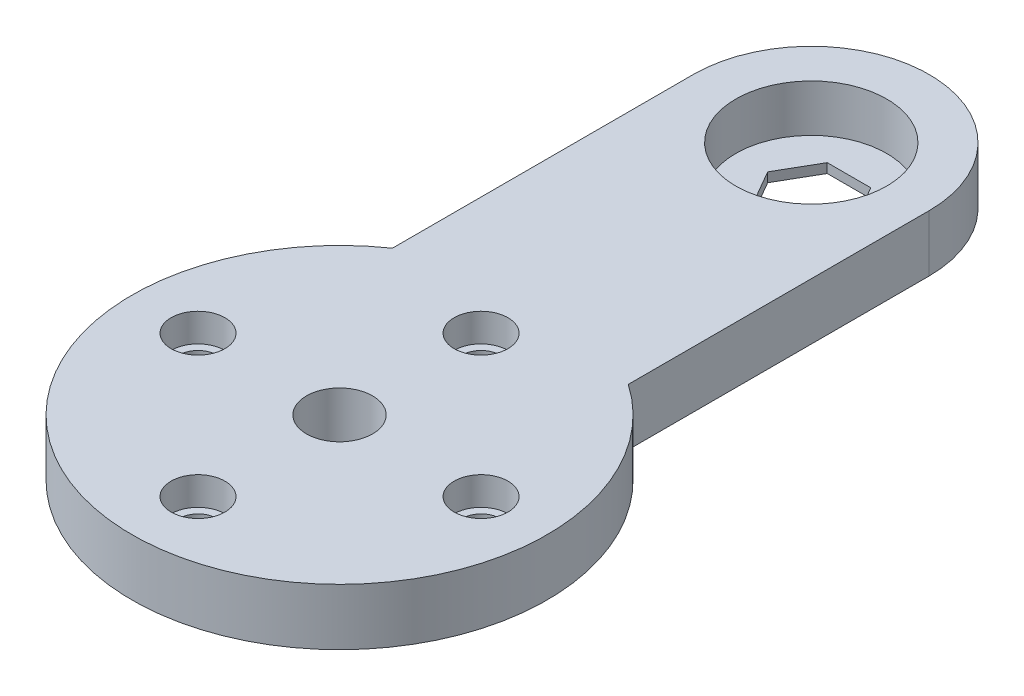
from build123d import *

# Parameters (mm, degrees)
BOSS_EXTRUDE1_DEPTH = 6
SKETCH2_R           = 2.85
CUT_EXTRUDE1_DEPTH  = 3
SKETCH3_R           = 2
SKETCH3_R_2         = 3.5
CUT_EXTRUDE2_DEPTH  = 76.524830354
SKETCH4_R           = 8
CUT_EXTRUDE3_DEPTH  = 5
SKETCH5_R           = 3.5
CUT_EXTRUDE4_DEPTH  = 76.524830354
CUT_EXTRUDE5_DEPTH  = 3


with BuildPart() as part:
    # Sketch1 → Boss-Extrude1 (new body)
    with BuildSketch(Plane(origin=(0, 0, 0), x_dir=(1, 0, 0), z_dir=(0, 1, 0))):
        with BuildLine():
            Line((-12.5, 0), (-12.5, -31.89613301))
            ThreePointArc((-12.5, -31.89613301), (0, -72), (12.5, -31.89613301))
            Line((12.5, -31.89613301), (12.5, 0))
            ThreePointArc((12.5, 0), (0, 12.5), (-12.5, 0))
        make_face()
    extrude(amount=BOSS_EXTRUDE1_DEPTH)

    # Sketch2 → Cut-Extrude1 (cut)
    with BuildSketch(Plane(origin=(0, 6, 0), x_dir=(1, 0, 0), z_dir=(0, 1, 0))):
        with Locations(Location((0, -35, 0), (0, 0, 270))):
            Circle(SKETCH2_R)
        with Locations(Location((15, -50, 0), (0, 0, 270))):
            Circle(SKETCH2_R)
        with Locations(Location((0, -65, 0), (0, 0, 270))):
            Circle(SKETCH2_R)
        with Locations(Location((-15, -50, 0), (0, 0, 270))):
            Circle(SKETCH2_R)
    extrude(amount=-CUT_EXTRUDE1_DEPTH, mode=Mode.SUBTRACT)

    # Sketch3 → Cut-Extrude2 (cut, through all)
    with BuildSketch(Plane(origin=(0, 6, 0), x_dir=(1, 0, 0), z_dir=(0, 1, 0))):
        with Locations(Location((0, -35, 0), (0, 0, 270))):
            Circle(SKETCH3_R)
        with Locations(Location((15, -50, 0), (0, 0, 270))):
            Circle(SKETCH3_R)
        with Locations(Location((0, -65, 0), (0, 0, 270))):
            Circle(SKETCH3_R)
        with Locations(Location((-15, -50, 0), (0, 0, 270))):
            Circle(SKETCH3_R)
        with Locations(Location((0, -50, 0), (0, 0, 270))):
            Circle(SKETCH3_R_2)
    extrude(amount=-CUT_EXTRUDE2_DEPTH, mode=Mode.SUBTRACT)

    # Sketch4 → Cut-Extrude3 (cut)
    with BuildSketch(Plane(origin=(0, 6, 0), x_dir=(1, 0, 0), z_dir=(0, 1, 0))):
        with Locations(Location((0, 0, 0), (0, 0, 270))):
            Circle(SKETCH4_R)
    extrude(amount=-CUT_EXTRUDE3_DEPTH, mode=Mode.SUBTRACT)

    # Sketch5 → Cut-Extrude4 (cut, through all)
    with BuildSketch(Plane(origin=(0, 6, 0), x_dir=(1, 0, 0), z_dir=(0, 1, 0))):
        with Locations(Location((0, 0, 0), (0, 0, 270))):
            Circle(SKETCH5_R)
    extrude(amount=-CUT_EXTRUDE4_DEPTH, mode=Mode.SUBTRACT)

    # Sketch6 → Cut-Extrude5 (cut)
    with BuildSketch(Plane.XZ):
        Polygon((4.618802154, 0), (2.309401077, 4), (-2.309401077, 4), (-4.618802154, 0), (-2.309401077, -4), (2.309401077, -4), align=None)
    extrude(amount=-CUT_EXTRUDE5_DEPTH, mode=Mode.SUBTRACT)


solid = part.part
